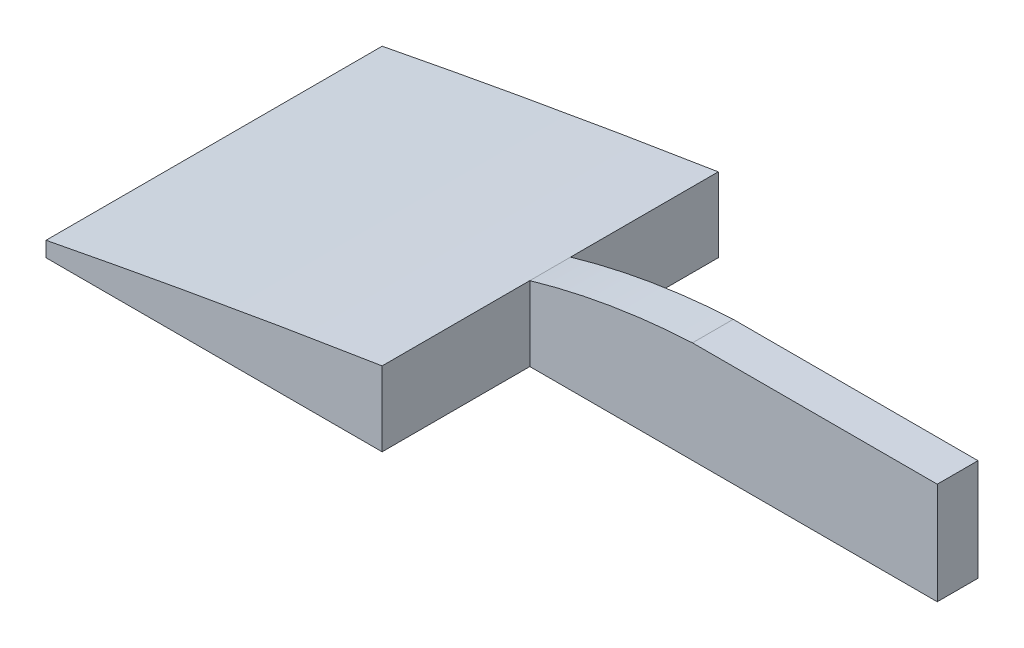
from build123d import *

# Parameters (mm, degrees)
ESQUISSE2_W             = 20
ESQUISSE2_H             = 2
ESQUISSE2_W_2           = 16.5
ESQUISSE2_H_2           = 16.5
BOSS_EXTRU_1_DEPTH      = 5
ENL_V_MAT_EXTRU_1_DEPTH = 17
ENL_V_MAT_EXTRU_2_DEPTH = 17


with BuildPart() as part:
    # Esquisse2 → Boss.-Extru.1 (new body)
    with BuildSketch(Plane(origin=(0, 0, 0), x_dir=(1, 0, 0), z_dir=(0, 1, 0))):
        with Locations((10, 1)):
            Rectangle(ESQUISSE2_W, ESQUISSE2_H)
        with Locations((-8.25, 1)):
            Rectangle(ESQUISSE2_W_2, ESQUISSE2_H_2)
    extrude(amount=BOSS_EXTRU_1_DEPTH)

    # Esquisse3 → Enlèv. mat.-Extru.1 (cut)
    with BuildSketch(Plane(origin=(0, 0, -9.25), x_dir=(-1, 0, 0), z_dir=(0, 0, -1))):
        with BuildLine():
            Line((0, 5), (0, 3.654066972))
            add(Edge.make_bspline(
                [(0, 3.654066972), (8.276287375, 2.347006327), (16.5, 0.744396355)],
                knots=[0, 0, 0, 1, 1, 1], degree=2))
            Line((16.5, 0.744396355), (18.688542218, 4.20494166))
            Line((18.688542218, 4.20494166), (16.723031274, 6.238601979))
            Line((16.723031274, 6.238601979), (3.598874135, 6.46224909))
            Line((3.598874135, 6.46224909), (0, 5))
        make_face()
    extrude(amount=-ENL_V_MAT_EXTRU_1_DEPTH, mode=Mode.SUBTRACT)

    # Esquisse4 → Enlèv. mat.-Extru.2 (cut)
    with BuildSketch(Plane.XY):
        with BuildLine():
            Line((0, 3.654066972), (0, 5))
            Line((0, 5), (7.983599521, 5))
            add(Edge.make_bspline(
                [(0, 3.654066972), (3.907893525, 4.793033974), (7.983599521, 5)],
                knots=[0, 0, 0, 1, 1, 1], degree=2))
        make_face()
    extrude(amount=-ENL_V_MAT_EXTRU_2_DEPTH, mode=Mode.SUBTRACT)


solid = part.part
